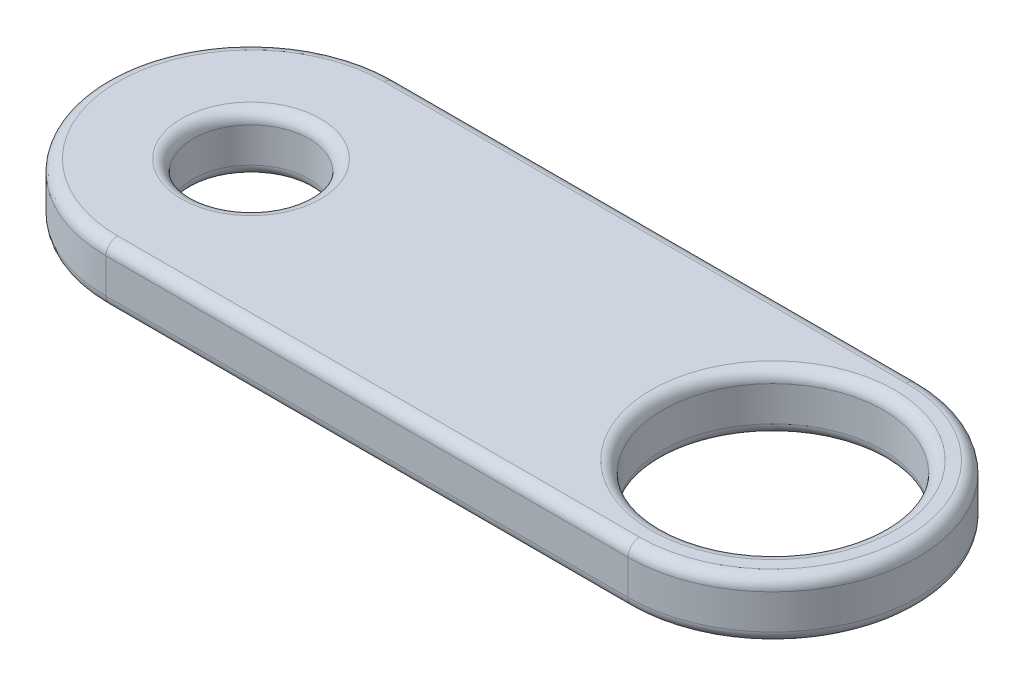
from build123d import *

# Parameters (mm, degrees)
SKETCH1_R           = 5
SKETCH1_R_2         = 9.5
BOSS_EXTRUDE1_DEPTH = 5
FILLET1_R           = 1


with BuildPart() as part:
    # Sketch1 → Boss-Extrude1 (new body)
    with BuildSketch(Plane(origin=(0, 0, 0), x_dir=(1, 0, 0), z_dir=(0, 1, 0))):
        with BuildLine():
            Line((45, 12.5), (0, 12.5))
            ThreePointArc((0, 12.5), (-12.5, 0), (0, -12.5))
            Line((0, -12.5), (45, -12.5))
            ThreePointArc((45, -12.5), (57.5, 0), (45, 12.5))
        make_face()
        with Locations(Location((0, 0, 0), (0, 0, 270))):
            Circle(SKETCH1_R, mode=Mode.SUBTRACT)
        with Locations(Location((45, 0, 0), (0, 0, 270))):
            Circle(SKETCH1_R_2, mode=Mode.SUBTRACT)
    extrude(amount=BOSS_EXTRUDE1_DEPTH)

    # Fillet1
    fillet1_edges = [part.edges().sort_by_distance(p)[0] for p in [
        (0, 0, -5),
        (0, 5, -5),
        (-12.5, 5, 0),
        (45, 0, -9.5),
        (45, 5, -9.5),
        (22.5, 5, 12.5),
        (57.5, 5, 0),
        (22.5, 0, 12.5),
        (-12.5, 0, 0),
        (22.5, 0, -12.5),
        (57.5, 0, 0),
        (22.5, 5, -12.5),
    ]]
    fillet(fillet1_edges, radius=FILLET1_R)


solid = part.part
